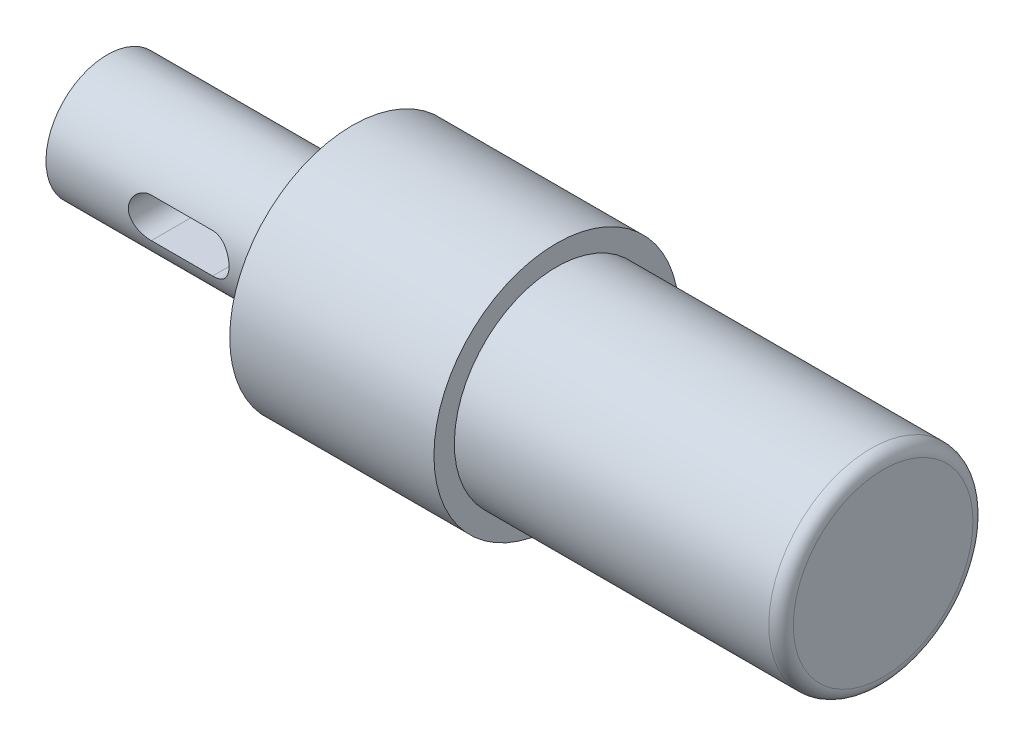
from build123d import *

# Parameters (mm, degrees)
FILLET1_R               = 3
SKETCH2_W               = 23.002294749
SKETCH2_H               = 32.038910542
CUT_EXTRUDE1_DEPTH      = 30
SKETCH3_R               = 6.178270045
CUT_EXTRUDE2_DEPTH      = 20
SKETCH4_R               = 10
CUT_EXTRUDE3_DEPTH      = 30
CUT_EXTRUDE4_DEPTH      = 137.747943453
CUT_EXTRUDE4_DEPTH_BACK = 33


with BuildPart() as part:
    # Sketch1 → Revolve1 (revolve)
    with BuildSketch(Plane.XY, mode=Mode.PRIVATE) as revolve1_sk:
        Polygon((0, 0), (-60, 0), (-60, 15), (0, 15), (0, 30), (50, 30), (50, 25), (130, 25), (130, 0), align=None)
    revolve(revolve1_sk.sketch.rotate(Axis((-83.2159872, 0, 0), (1, 0, 0)), 180), axis=Axis((-83.2159872, 0, 0), (1, 0, 0)))

    # Fillet1
    fillet1_edges = [part.edges().sort_by_distance(p)[0] for p in [
        (130, 25, 0),
    ]]
    fillet(fillet1_edges, radius=FILLET1_R)

    # Sketch2 → Cut-Extrude1 (cut)
    with BuildSketch(Plane.XY):
        with Locations((79.66963489, 1.540332238)):
            Rectangle(SKETCH2_W, SKETCH2_H)
    extrude(amount=-CUT_EXTRUDE1_DEPTH, mode=Mode.SUBTRACT)

    # Sketch3 → Cut-Extrude2 (cut)
    with BuildSketch(Plane(origin=(0, 0, 0), x_dir=(-1, 0, 0), z_dir=(0, 0, -1))):
        with Locations((-79.938300401, 1.139218287)):
            Circle(SKETCH3_R)
    extrude(amount=-CUT_EXTRUDE2_DEPTH, mode=Mode.SUBTRACT)

    # Sketch4 → Cut-Extrude3 (cut)
    with BuildSketch(Plane.XY):
        with Locations((24.012296705, 2.977975659)):
            Circle(SKETCH4_R)
    extrude(amount=-CUT_EXTRUDE3_DEPTH, mode=Mode.SUBTRACT)

    # Sketch6 → Cut-Extrude4 (cut, two sides: drawn at the far end of the back side and taken through both)
    with BuildSketch(Plane.XY.offset(-CUT_EXTRUDE4_DEPTH_BACK)):
        with BuildLine():
            Line((-35, 4.826374344), (-20, 4.826374344))
            ThreePointArc((-20, 4.826374344), (-15.173625656, 0), (-20, -4.826374344))
            Line((-20, -4.826374344), (-35, -4.826374344))
            ThreePointArc((-35, -4.826374344), (-39.826374344, 0), (-35, 4.826374344))
        make_face()
    extrude(amount=CUT_EXTRUDE4_DEPTH + CUT_EXTRUDE4_DEPTH_BACK, mode=Mode.SUBTRACT)


solid = part.part
